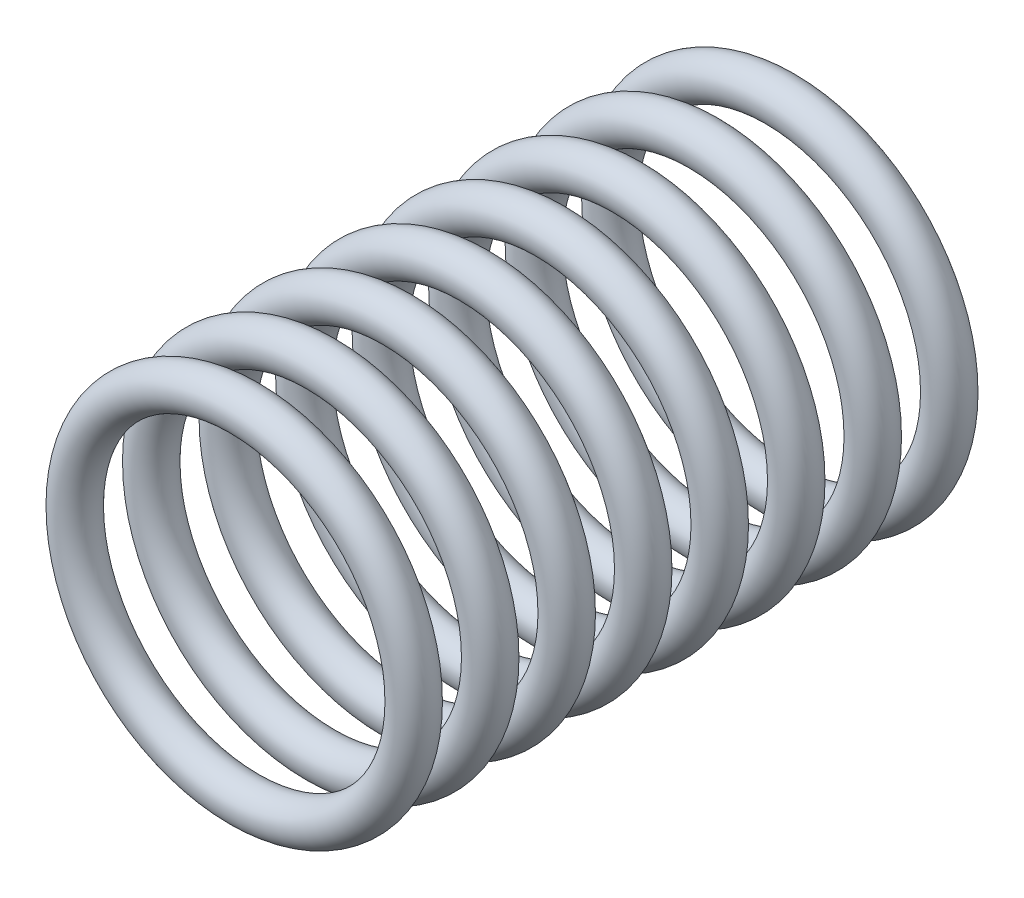
from build123d import *

# Parameters (mm, degrees)
SKETCH_1_R = 0.6


with BuildPart() as part:
    # 草图1 → 旋转1 (revolve)
    with BuildSketch(Plane(origin=(0, 0, 0), x_dir=(1, 0, 0), z_dir=(0, 1, 0)), mode=Mode.PRIVATE) as revolve_1_sk:
        with Locations((5, -0.6)):
            Circle(SKETCH_1_R)
        with Locations((5, -2.8571)):
            Circle(SKETCH_1_R)
        with Locations((5, -5.1143)):
            Circle(SKETCH_1_R)
        with Locations((5, -7.3714)):
            Circle(SKETCH_1_R)
        with Locations((5, -9.6286)):
            Circle(SKETCH_1_R)
        with Locations((5, -11.8857)):
            Circle(SKETCH_1_R)
        with Locations((5, -14.1429)):
            Circle(SKETCH_1_R)
        with Locations((5, -16.4)):
            Circle(SKETCH_1_R)
    revolve(revolve_1_sk.sketch.rotate(Axis((0, 0, 0), (0, 0, 1)), 180), axis=Axis((0, 0, 0), (0, 0, 1)))


solid = part.part
